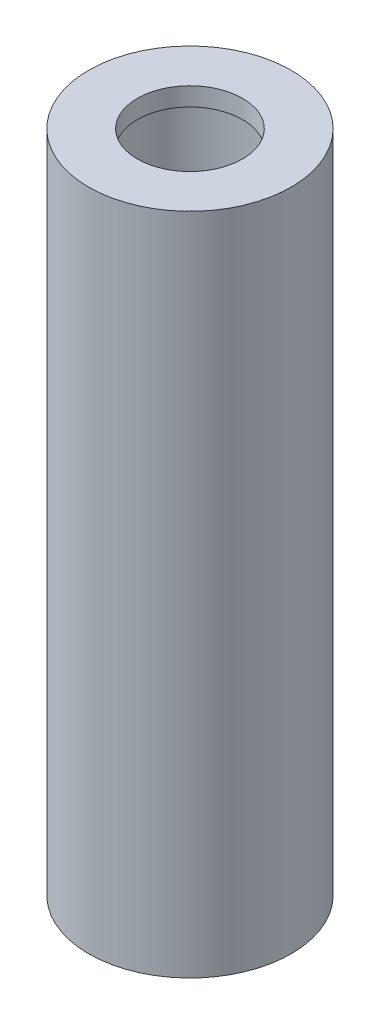
from build123d import *

# Parameters (mm, degrees)
SKETCH1_R           = 3.85
SKETCH1_R_2         = 2.6
BOSS_EXTRUDE1_DEPTH = 25.25
BOSS_EXTRUDE2_START = -0.7
SKETCH2_R           = 3.85
SKETCH2_R_2         = 2
BOSS_EXTRUDE2_DEPTH = 0.7


with BuildPart() as part:
    # Sketch1 → Boss-Extrude1 (new body)
    with BuildSketch(Plane(origin=(0, 0, 0), x_dir=(1, 0, 0), z_dir=(0, 1, 0))):
        with Locations(Location((0, 0, 0), (0, 0, 270))):
            Circle(SKETCH1_R)
        with Locations(Location((0, 0, 0), (0, 0, 270))):
            Circle(SKETCH1_R_2, mode=Mode.SUBTRACT)
    extrude(amount=BOSS_EXTRUDE1_DEPTH)

    # Sketch2 → Boss-Extrude2 (add)
    with BuildSketch(Plane(origin=(0, 25.25, 0), x_dir=(1, 0, 0), z_dir=(0, 1, 0)).offset(BOSS_EXTRUDE2_START)):
        with Locations(Location((0, 0, 0), (0, 0, 270))):
            Circle(SKETCH2_R)
        with Locations(Location((0, 0, 0), (0, 0, 270))):
            Circle(SKETCH2_R_2, mode=Mode.SUBTRACT)
    extrude(amount=BOSS_EXTRUDE2_DEPTH)


solid = part.part
